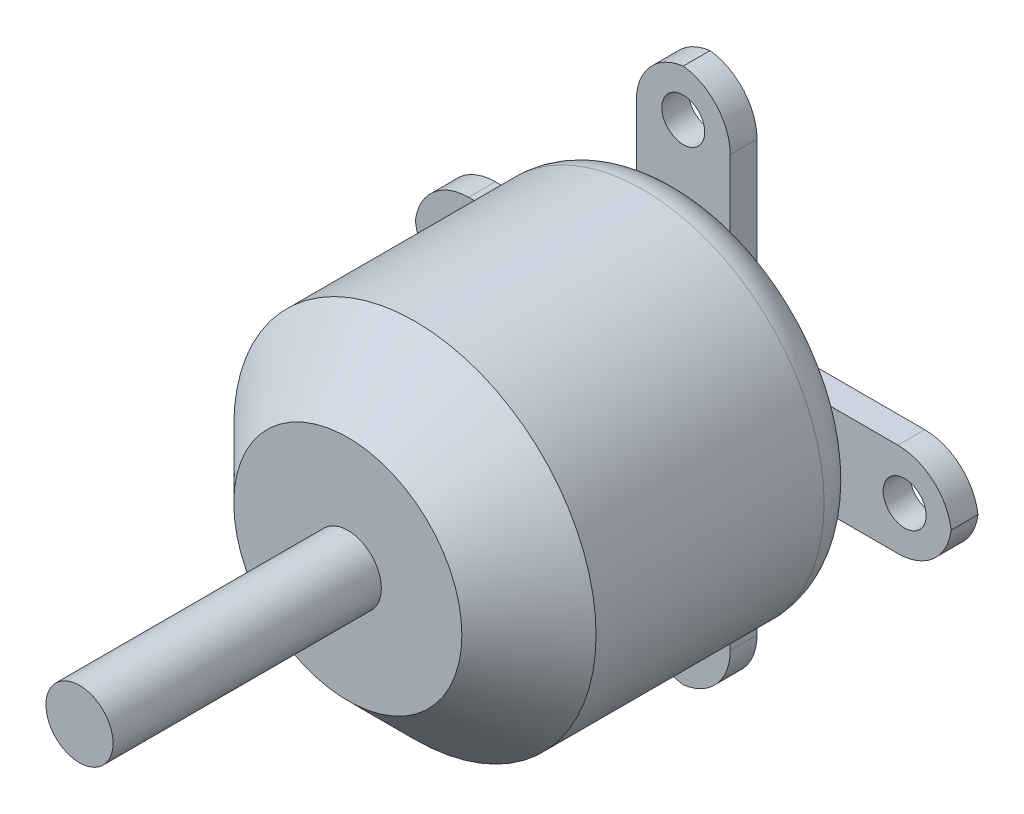
from build123d import *

# Parameters (mm, degrees)
SKETCH1_R           = 13.5
BOSS_EXTRUDE1_DEPTH = 25
SKETCH2_R           = 2.5
BOSS_EXTRUDE2_DEPTH = 20
FILLET1_R           = 3
CHAMFER1_SIZE       = 5
SKETCH3_R           = 1.6
BOSS_EXTRUDE3_DEPTH = 2
SKETCH4_R           = 4
CUT_EXTRUDE1_DEPTH  = 2


with BuildPart() as part:
    # Sketch1 → Boss-Extrude1 (new body)
    with BuildSketch(Plane.XY):
        Circle(SKETCH1_R)
    extrude(amount=BOSS_EXTRUDE1_DEPTH)

    # Sketch2 → Boss-Extrude2 (add)
    with BuildSketch(Plane.XY.offset(25)):
        Circle(SKETCH2_R)
    extrude(amount=BOSS_EXTRUDE2_DEPTH)

    # Fillet1
    fillet1_edges = [part.edges().sort_by_distance(p)[0] for p in [
        (-13.5, 0, 0),
    ]]
    fillet(fillet1_edges, radius=FILLET1_R)

    # Chamfer1
    chamfer1_edges = [part.edges().sort_by_distance(p)[0] for p in [
        (-13.5, 0, 25),
    ]]
    chamfer(chamfer1_edges, length=CHAMFER1_SIZE)

    # Sketch3 → Boss-Extrude3 (add)
    with BuildSketch(Plane(origin=(0, 0, 0), x_dir=(-1, 0, 0), z_dir=(0, 0, -1))):
        with BuildLine():
            Line((-3.5, -7.5), (-3.5, -16))
            ThreePointArc((-3.5, -16), (-2.5, -18.645751311), (0, -19.968626967))
            ThreePointArc((0, -19.968626967), (2.5, -18.645751311), (3.5, -16))
            Line((3.5, -16), (3.5, -7.5))
            ThreePointArc((3.5, -7.5), (4.671572875, -4.671572875), (7.5, -3.5))
            Line((7.5, -3.5), (16, -3.5))
            ThreePointArc((16, -3.5), (18.645751311, -2.5), (19.968626967, 0))
            ThreePointArc((19.968626967, 0), (18.645751311, 2.5), (16, 3.5))
            Line((16, 3.5), (7.5, 3.5))
            ThreePointArc((7.5, 3.5), (4.671572875, 4.671572875), (3.5, 7.5))
            Line((3.5, 7.5), (3.5, 16))
            ThreePointArc((3.5, 16), (2.5, 18.645751311), (0, 19.968626967))
            ThreePointArc((0, 19.968626967), (-2.5, 18.645751311), (-3.5, 16))
            Line((-3.5, 16), (-3.5, 7.5))
            ThreePointArc((-3.5, 7.5), (-4.671572875, 4.671572875), (-7.5, 3.5))
            Line((-7.5, 3.5), (-16, 3.5))
            ThreePointArc((-16, 3.5), (-18.645751311, 2.5), (-19.968626967, 0))
            ThreePointArc((-19.968626967, 0), (-18.645751311, -2.5), (-16, -3.5))
            Line((-16, -3.5), (-7.5, -3.5))
            ThreePointArc((-7.5, -3.5), (-4.671572875, -4.671572875), (-3.5, -7.5))
        make_face()
        with Locations((-16.5, 0)):
            Circle(SKETCH3_R, mode=Mode.SUBTRACT)
        with Locations((0, 16.5)):
            Circle(SKETCH3_R, mode=Mode.SUBTRACT)
        with Locations((16.5, 0)):
            Circle(SKETCH3_R, mode=Mode.SUBTRACT)
        with Locations((0, -16.5)):
            Circle(SKETCH3_R, mode=Mode.SUBTRACT)
    extrude(amount=BOSS_EXTRUDE3_DEPTH)

    # Sketch4 → Cut-Extrude1 (cut)
    with BuildSketch(Plane(origin=(0, 0, -2), x_dir=(-1, 0, 0), z_dir=(0, 0, -1))):
        Circle(SKETCH4_R)
    extrude(amount=-CUT_EXTRUDE1_DEPTH, mode=Mode.SUBTRACT)


solid = part.part
